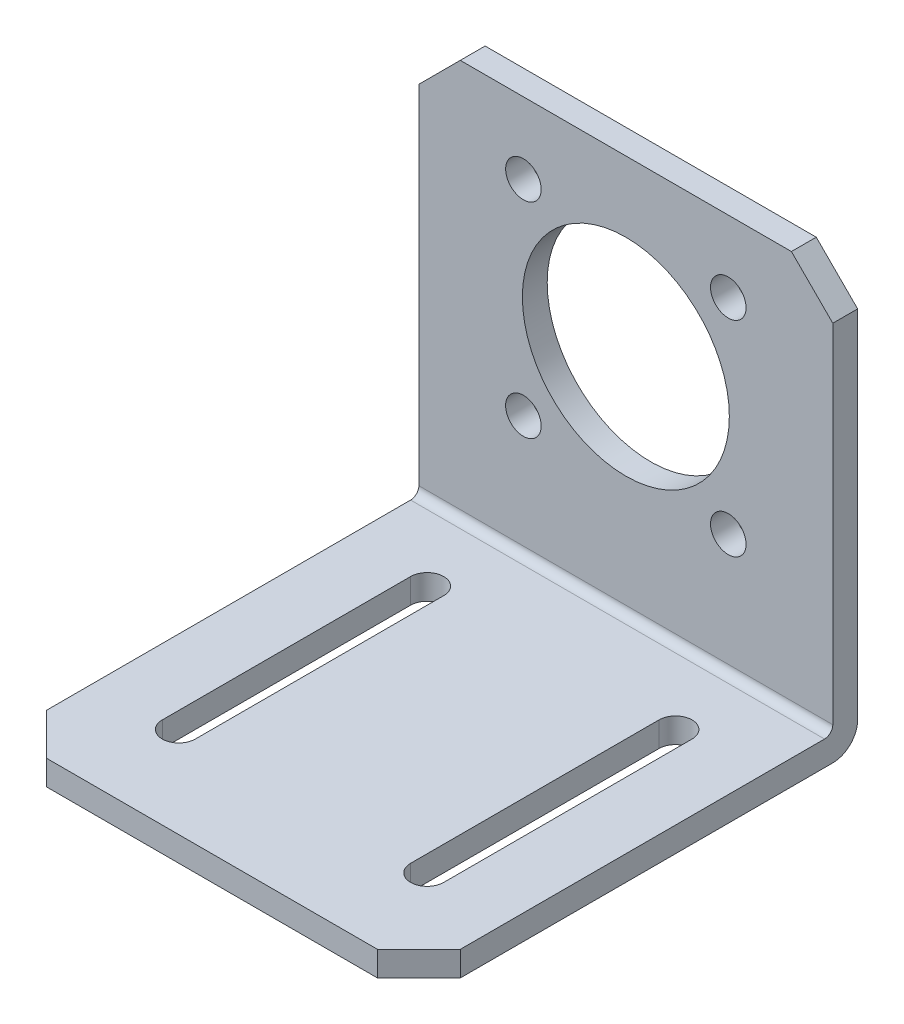
from build123d import *

# Parameters (mm, degrees)
EXTRUDE_1_DEPTH     = 50
CHAMFER_1_SIZE      = 5
FILLET_1_R          = 1
SKETCH_2_R          = 12.5
SKETCH_2_R_2        = 2.147801841
CUT_EXTRUDE_1_DEPTH = 84.432542833
CUT_EXTRUDE_2_DEPTH = 80.287617379


with BuildPart() as part:
    # 스케치1 → 보스-돌출1 (new body)
    with BuildSketch(Plane(origin=(0, 0, 0), x_dir=(0, 0, -1), z_dir=(1, 0, 0))):
        with BuildLine():
            Line((-18.568527919, -10.355329949), (31.431472081, -10.355329949))
            ThreePointArc((31.431472081, -10.355329949), (33.552792425, -9.476650293), (34.431472081, -7.355329949))
            Line((34.431472081, -7.355329949), (34.431472081, 40.644670051))
            Line((34.431472081, 40.644670051), (31.431472081, 40.644670051))
            Line((31.431472081, 40.644670051), (31.431472081, -7.355329949))
            Line((31.431472081, -7.355329949), (-18.568527919, -7.355329949))
            Line((-18.568527919, -7.355329949), (-18.568527919, -10.355329949))
        make_face()
    extrude(amount=EXTRUDE_1_DEPTH)

    # 모따기1
    chamfer_1_edges = [part.edges().sort_by_distance(p)[0] for p in [
        (0, -8.855329949, 18.568527919),
        (50, 40.644670051, -32.931472081),
        (50, -8.855329949, 18.568527919),
        (0, 40.644670051, -32.931472081),
    ]]
    chamfer(chamfer_1_edges, length=CHAMFER_1_SIZE)

    # 필렛1
    fillet_1_edges = [part.edges().sort_by_distance(p)[0] for p in [
        (25, -7.355329949, -31.431472081),
    ]]
    fillet(fillet_1_edges, radius=FILLET_1_R)

    # 스케치2 → 컷-돌출1 (cut, through all)
    with BuildSketch(Plane(origin=(0, 0, -34.431472081), x_dir=(-1, 0, 0), z_dir=(0, 0, -1))):
        with Locations((-25, 19.644670051)):
            Circle(SKETCH_2_R)
        with Locations((-37.374368671, 32.019038722)):
            Circle(SKETCH_2_R_2)
        with Locations(Location((-12.625631329, 32.019038722, 0), (0, 0, 90))):
            Circle(SKETCH_2_R_2)
        with Locations((-12.625631329, 7.27030138)):
            Circle(SKETCH_2_R_2)
        with Locations(Location((-37.374368671, 7.27030138, 0), (0, 0, 90))):
            Circle(SKETCH_2_R_2)
    extrude(amount=-CUT_EXTRUDE_1_DEPTH, mode=Mode.SUBTRACT)

    # 스케치3 → 컷-돌출2 (cut, through all)
    with BuildSketch(Plane.XZ.offset(10.355329949)):
        with BuildLine():
            Line((12, 7.568527919), (12, -22.431472081))
            ThreePointArc((12, -22.431472081), (10, -24.431472081), (8, -22.431472081))
            Line((8, -22.431472081), (8, 7.568527919))
            ThreePointArc((8, 7.568527919), (10, 9.568527919), (12, 7.568527919))
        make_face()
        with BuildLine():
            Line((42, 7.568527919), (42, -22.431472081))
            ThreePointArc((42, -22.431472081), (40, -24.431472081), (38, -22.431472081))
            Line((38, -22.431472081), (38, 7.568527919))
            ThreePointArc((38, 7.568527919), (40, 9.568527919), (42, 7.568527919))
        make_face()
    extrude(amount=-CUT_EXTRUDE_2_DEPTH, mode=Mode.SUBTRACT)


solid = part.part
